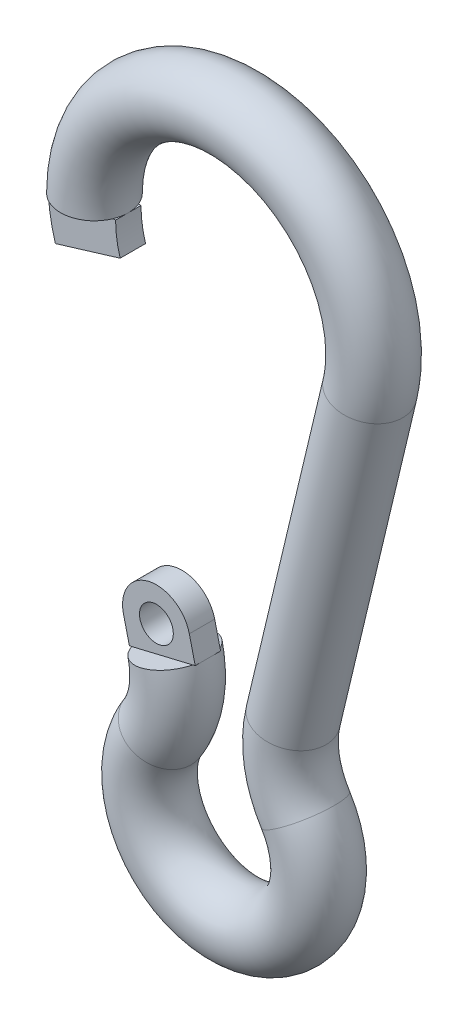
from build123d import *

# Parameters (mm, degrees)
SWEEP1_PROFILE_R    = 4
SKETCH12_R          = 2
BOSS_EXTRUDE1_DEPTH = 1.5


with BuildPart() as part:
    # Sweep1: sweep along a path in Sketch2
    with BuildLine(Plane.XY) as sweep1_path:
        ThreePointArc((-16.5, 0), (1.928394438, 16.38692451), (16.049247866, -3.83035807))
        Line((16.049247866, -3.83035807), (6.980062703, -41.830356497))
        ThreePointArc((6.980062703, -41.830356497), (6.822175971, -46.389411803), (8.449256802, -50.651162791))
        ThreePointArc((8.449256802, -50.651162791), (0, -66), (-8.449256802, -50.651162791))
        ThreePointArc((-8.449256802, -50.651162791), (-6.822175971, -46.389411803), (-6.980062703, -41.830356497))
    # Sweep1 profile (on start of the path) → Sweep1 (sweep)
    with BuildSketch(Plane(origin=(-16.5, 0, 0), x_dir=(1, 0, 0), z_dir=(0, 1, 0))):
        Circle(SWEEP1_PROFILE_R)
    sweep(path=sweep1_path.line)

    # Sketch12 → Boss-Extrude1 (add, symmetric)
    # profile 1 of 2: a face of its own
    with BuildSketch(Plane.XY):
        with BuildLine():
            Line((-19.614596936, -5.959663332), (-11.960120083, -3.633941056))
            ThreePointArc((-11.960120083, -3.633941056), (-12.364293369, -1.83691303), (-12.5, 0))
            Line((-12.5, 0), (-20.5, 0))
            ThreePointArc((-20.5, 0), (-20.277441125, -3.01253737), (-19.614596936, -5.959663332))
        make_face()
    # profile 2 of 2: a face of its own
    with BuildSketch(Plane.XY):
        with BuildLine():
            Line((-3.089335948, -40.901784844), (-10.870789458, -42.75892815))
            Line((-10.870789458, -42.75892815), (-11.567218198, -39.840883084))
            ThreePointArc((-11.567218198, -39.840883084), (-8.605063096, -35.021584675), (-3.785764688, -37.983739777))
            Line((-3.785764688, -37.983739777), (-3.089335948, -40.901784844))
        make_face()
        with Locations((-7.676491443, -38.91231143)):
            Circle(SKETCH12_R, mode=Mode.SUBTRACT)
    extrude(amount=BOSS_EXTRUDE1_DEPTH, both=True)


solid = part.part
